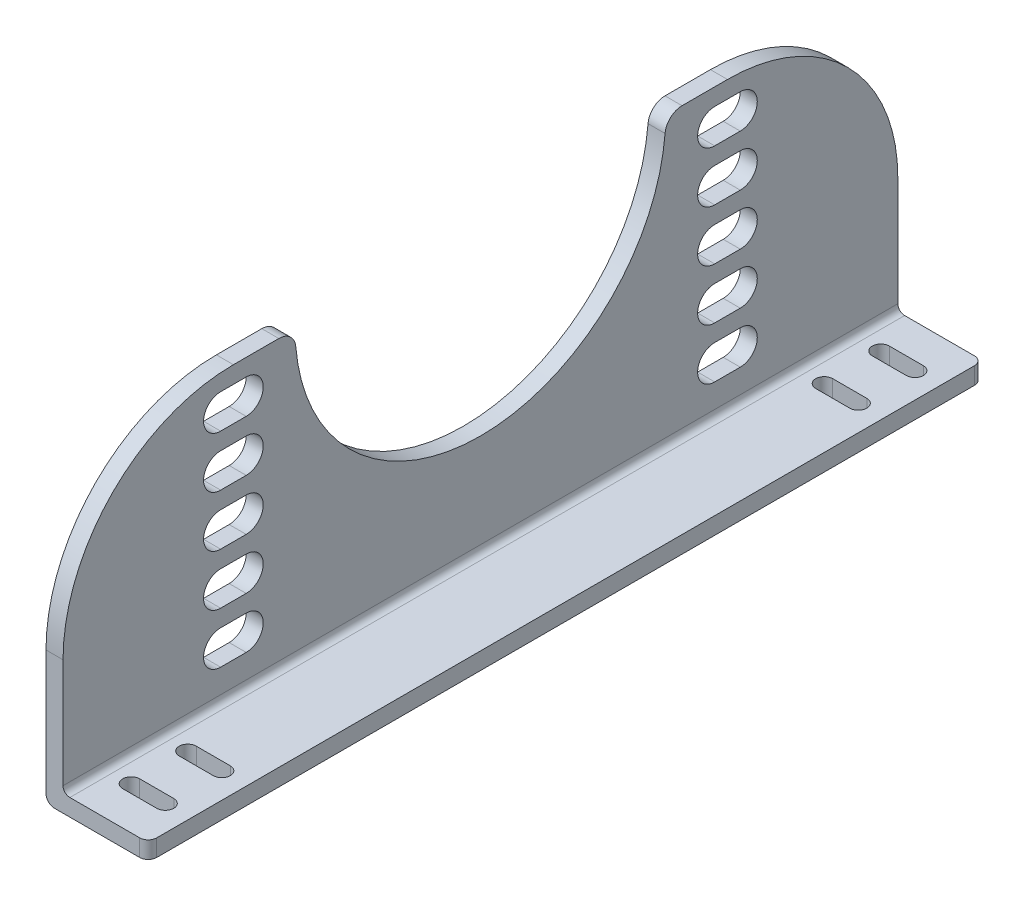
from build123d import *

# Parameters (mm, degrees)
SZKIC1_W                    = 10
SZKIC1_H                    = 178
DODANIE_WYCI_GNI_CIE1_DEPTH = 490
WYTNIJ_WYCI_GNI_CIE1_DEPTH  = 522.424970633
WYTNIJ_WYCI_GNI_CIE2_DEPTH  = 522.424970633
ZAOKR_GLENIE1_R             = 100
ZAOKR_GLENIE2_R             = 100
WYTNIJ_WYCI_GNI_CIE3_DEPTH  = 522.424970633
ZAOKR_GLENIE3_R             = 10
SZKIC6_W                    = 60
SZKIC6_H                    = 10
DODANIE_WYCI_GNI_CIE2_DEPTH = 490
ZAOKR_GLENIE4_R             = 5
ZAOKR_GLENIE5_R             = 4
ZAOKR_GLENIE6_R             = 5
WYTNIJ_WYCI_GNI_CIE4_DEPTH  = 10
WYTNIJ_WYCI_GNI_CIE5_DEPTH  = 10


with BuildPart() as part:
    # Szkic1 → Dodanie-wyciągnięcie1 (new body)
    with BuildSketch(Plane.XY):
        with Locations((-5, 89)):
            Rectangle(SZKIC1_W, SZKIC1_H)
    extrude(amount=DODANIE_WYCI_GNI_CIE1_DEPTH)

    # Szkic2 → Wytnij-wyciągnięcie1 (cut, through all)
    with BuildSketch(Plane(origin=(0, 0, 0), x_dir=(0, 0, -1), z_dir=(1, 0, 0))):
        with BuildLine():
            Line((-107.5, 168), (-92.5, 168))
            ThreePointArc((-92.5, 168), (-82.5, 158), (-92.5, 148))
            Line((-92.5, 148), (-107.5, 148))
            ThreePointArc((-107.5, 148), (-117.5, 158), (-107.5, 168))
        make_face()
        with BuildLine():
            Line((-107.5, 138), (-92.5, 138))
            ThreePointArc((-92.5, 138), (-82.5, 128), (-92.5, 118))
            Line((-92.5, 118), (-107.5, 118))
            ThreePointArc((-107.5, 118), (-117.5, 128), (-107.5, 138))
        make_face()
        with BuildLine():
            Line((-107.5, 108), (-92.5, 108))
            ThreePointArc((-92.5, 108), (-82.5, 98), (-92.5, 88))
            Line((-92.5, 88), (-107.5, 88))
            ThreePointArc((-107.5, 88), (-117.5, 98), (-107.5, 108))
        make_face()
        with BuildLine():
            Line((-107.5, 78), (-92.5, 78))
            ThreePointArc((-92.5, 78), (-82.5, 68), (-92.5, 58))
            Line((-92.5, 58), (-107.5, 58))
            ThreePointArc((-107.5, 58), (-117.5, 68), (-107.5, 78))
        make_face()
        with BuildLine():
            Line((-107.5, 48), (-92.5, 48))
            ThreePointArc((-92.5, 48), (-82.5, 38), (-92.5, 28))
            Line((-92.5, 28), (-107.5, 28))
            ThreePointArc((-107.5, 28), (-117.5, 38), (-107.5, 48))
        make_face()
    extrude(amount=-WYTNIJ_WYCI_GNI_CIE1_DEPTH, mode=Mode.SUBTRACT)

    # Szkic3 → Wytnij-wyciągnięcie2 (cut, through all)
    with BuildSketch(Plane(origin=(0, 0, 0), x_dir=(0, 0, -1), z_dir=(1, 0, 0))):
        with BuildLine():
            Line((-397.5, 168), (-382.5, 168))
            ThreePointArc((-382.5, 168), (-372.5, 158), (-382.5, 148))
            Line((-382.5, 148), (-397.5, 148))
            ThreePointArc((-397.5, 148), (-407.5, 158), (-397.5, 168))
        make_face()
        with BuildLine():
            Line((-397.5, 138), (-382.5, 138))
            ThreePointArc((-382.5, 138), (-372.5, 128), (-382.5, 118))
            Line((-382.5, 118), (-397.5, 118))
            ThreePointArc((-397.5, 118), (-407.5, 128), (-397.5, 138))
        make_face()
        with BuildLine():
            Line((-397.5, 108), (-382.5, 108))
            ThreePointArc((-382.5, 108), (-372.5, 98), (-382.5, 88))
            Line((-382.5, 88), (-397.5, 88))
            ThreePointArc((-397.5, 88), (-407.5, 98), (-397.5, 108))
        make_face()
        with BuildLine():
            Line((-397.5, 78), (-382.5, 78))
            ThreePointArc((-382.5, 78), (-372.5, 68), (-382.5, 58))
            Line((-382.5, 58), (-397.5, 58))
            ThreePointArc((-397.5, 58), (-407.5, 68), (-397.5, 78))
        make_face()
        with BuildLine():
            Line((-397.5, 48), (-382.5, 48))
            ThreePointArc((-382.5, 48), (-372.5, 38), (-382.5, 28))
            Line((-382.5, 28), (-397.5, 28))
            ThreePointArc((-397.5, 28), (-407.5, 38), (-397.5, 48))
        make_face()
    extrude(amount=-WYTNIJ_WYCI_GNI_CIE2_DEPTH, mode=Mode.SUBTRACT)

    # Zaokrąglenie1
    zaokr_glenie1_edges = [part.edges().sort_by_distance(p)[0] for p in [
        (-5, 178, 0),
    ]]
    fillet(zaokr_glenie1_edges, radius=ZAOKR_GLENIE1_R)

    # Zaokrąglenie2
    zaokr_glenie2_edges = [part.edges().sort_by_distance(p)[0] for p in [
        (-5, 178, 490),
    ]]
    fillet(zaokr_glenie2_edges, radius=ZAOKR_GLENIE2_R)

    # Szkic5 → Wytnij-wyciągnięcie3 (cut, through all)
    with BuildSketch(Plane.ZY.offset(10)):
        with BuildLine():
            Line((136.235236097, 178), (353.764763903, 178))
            ThreePointArc((353.764763903, 178), (245, 69.235236097), (136.235236097, 178))
        make_face()
    extrude(amount=-WYTNIJ_WYCI_GNI_CIE3_DEPTH, mode=Mode.SUBTRACT)

    # Zaokrąglenie3
    zaokr_glenie3_edges = [part.edges().sort_by_distance(p)[0] for p in [
        (-5, 178, 353.764763903),
        (-5, 178, 136.235236097),
    ]]
    fillet(zaokr_glenie3_edges, radius=ZAOKR_GLENIE3_R)

    # Szkic6 → Dodanie-wyciągnięcie2 (add, through all)
    with BuildSketch(Plane(origin=(0, 0, 0), x_dir=(-1, 0, 0), z_dir=(0, 0, -1))):
        with Locations((-20, 5)):
            Rectangle(SZKIC6_W, SZKIC6_H)
    extrude(amount=-DODANIE_WYCI_GNI_CIE2_DEPTH)

    # Zaokrąglenie4
    zaokr_glenie4_edges = [part.edges().sort_by_distance(p)[0] for p in [
        (-10, 0, 245),
    ]]
    fillet(zaokr_glenie4_edges, radius=ZAOKR_GLENIE4_R)

    # Zaokrąglenie5
    zaokr_glenie5_edges = [part.edges().sort_by_distance(p)[0] for p in [
        (0, 10, 245),
    ]]
    fillet(zaokr_glenie5_edges, radius=ZAOKR_GLENIE5_R)

    # Zaokrąglenie6
    zaokr_glenie6_edges = [part.edges().sort_by_distance(p)[0] for p in [
        (50, 5, 0),
        (50, 5, 490),
    ]]
    fillet(zaokr_glenie6_edges, radius=ZAOKR_GLENIE6_R)

    # Szkic7 → Wytnij-wyciągnięcie4 (cut)
    with BuildSketch(Plane(origin=(0, 10, 0), x_dir=(1, 0, 0), z_dir=(0, 1, 0))):
        with BuildLine():
            Line((35, -470), (15, -470))
            ThreePointArc((15, -470), (10, -465), (15, -460))
            Line((15, -460), (35, -460))
            ThreePointArc((35, -460), (40, -465), (35, -470))
        make_face()
    wytnij_wyci_gni_cie4 = extrude(amount=-WYTNIJ_WYCI_GNI_CIE4_DEPTH, mode=Mode.SUBTRACT)

    # Lustro2: Wytnij-wyciągnięcie4 across plane
    add(wytnij_wyci_gni_cie4.mirror(Plane(origin=(0, 0, 245), x_dir=(1, 0, 0), z_dir=(0, 0, -1))), mode=Mode.SUBTRACT)

    # Szkic8 → Wytnij-wyciągnięcie5 (cut)
    with BuildSketch(Plane(origin=(0, 10, 0), x_dir=(1, 0, 0), z_dir=(0, 1, 0))):
        with BuildLine():
            Line((15, -426.8), (35, -426.8))
            ThreePointArc((35, -426.8), (40, -431.8), (35, -436.8))
            Line((35, -436.8), (15, -436.8))
            ThreePointArc((15, -436.8), (10, -431.8), (15, -426.8))
        make_face()
    wytnij_wyci_gni_cie5 = extrude(amount=-WYTNIJ_WYCI_GNI_CIE5_DEPTH, mode=Mode.SUBTRACT)

    # Lustro3: Wytnij-wyciągnięcie5 across plane
    add(wytnij_wyci_gni_cie5.mirror(Plane(origin=(0, 0, 245), x_dir=(1, 0, 0), z_dir=(0, 0, -1))), mode=Mode.SUBTRACT)


solid = part.part
